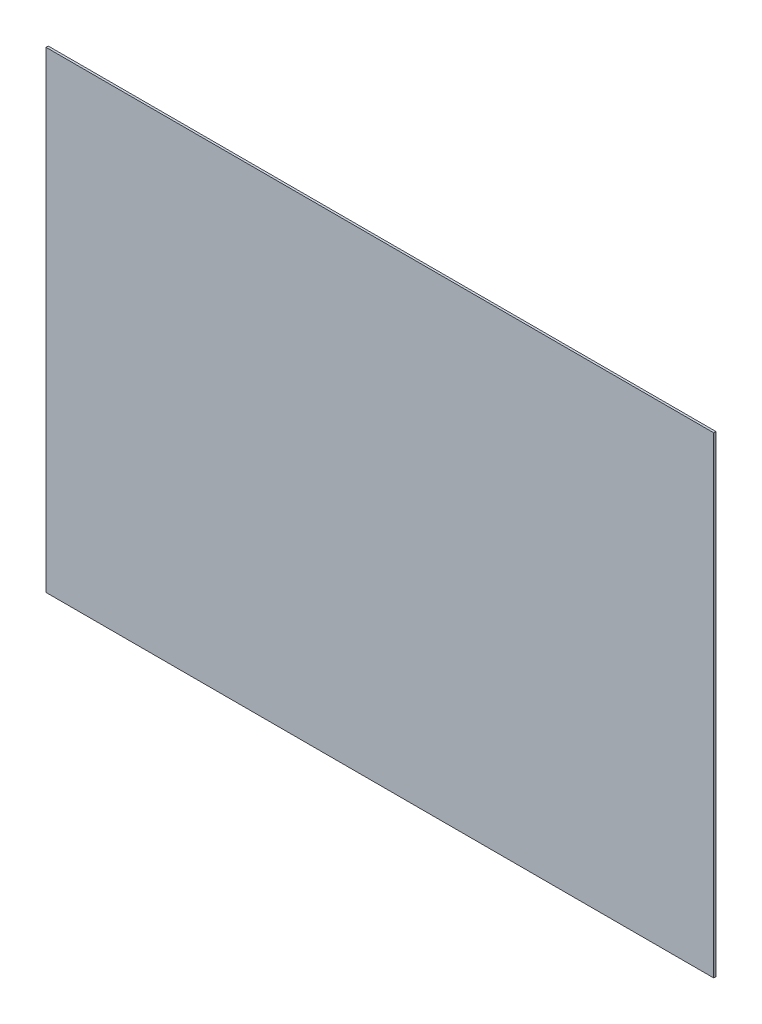
from build123d import *

# Parameters (mm, degrees)
SKETCH1_W           = 297
SKETCH1_H           = 210
BOSS_EXTRUDE1_DEPTH = 1


with BuildPart() as part:
    # Sketch1 → Boss-Extrude1 (new body)
    with BuildSketch(Plane.XY):
        with Locations((94.406647906, -76.181034639)):
            Rectangle(SKETCH1_W, SKETCH1_H)
    extrude(amount=BOSS_EXTRUDE1_DEPTH)


solid = part.part
